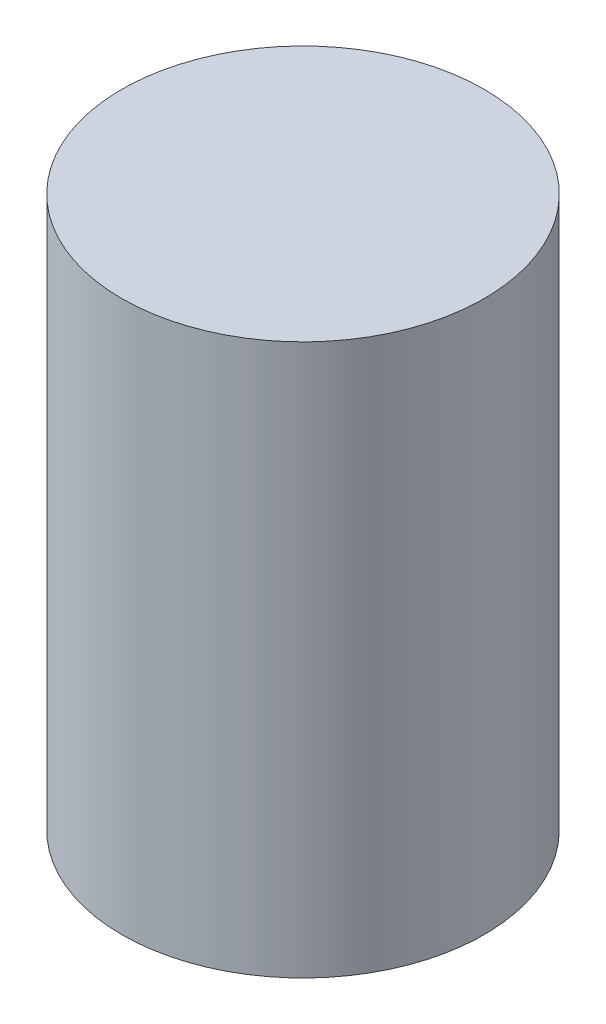
from build123d import *

# Parameters (mm, degrees)
SKETCH2_R           = 76.2
BOSS_EXTRUDE1_DEPTH = 231.648


with BuildPart() as part:
    # Sketch2 → Boss-Extrude1 (new body)
    with BuildSketch(Plane(origin=(0, 0, 0), x_dir=(1, 0, 0), z_dir=(0, 1, 0))):
        with Locations(Location((0, 0, 0), (0, 0, 270))):
            Circle(SKETCH2_R)
    extrude(amount=BOSS_EXTRUDE1_DEPTH)


solid = part.part
